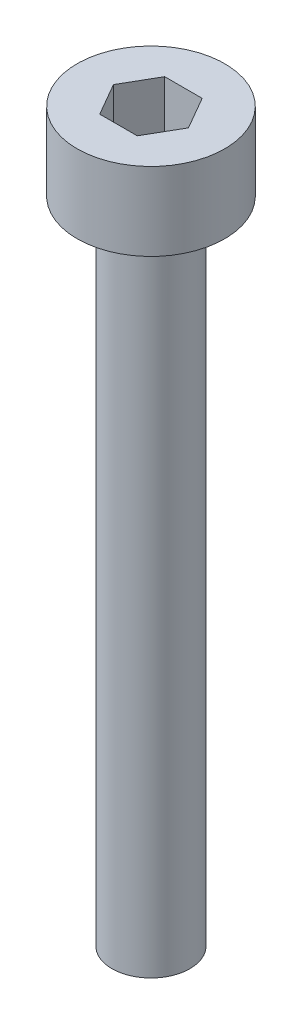
from build123d import *

# Parameters (mm, degrees)
SKETCH1_R           = 2.84
BOSS_EXTRUDE1_DEPTH = 3
SKETCH2_R           = 1.5
BOSS_EXTRUDE2_DEPTH = 25


with BuildPart() as part:
    # Sketch1 → Boss-Extrude1 (new body)
    with BuildSketch(Plane(origin=(0, 0, 0), x_dir=(1, 0, 0), z_dir=(0, 1, 0))):
        with Locations(Location((0, 0, 0), (0, 0, 270))):
            Circle(SKETCH1_R)
        Polygon((0.721687836, 1.25), (-0.721687836, 1.25), (-1.443375673, 0), (-0.721687836, -1.25), (0.721687836, -1.25), (1.443375673, 0), align=None, mode=Mode.SUBTRACT)
    extrude(amount=BOSS_EXTRUDE1_DEPTH)

    # Sketch2 → Boss-Extrude2 (add)
    with BuildSketch(Plane.XZ):
        with Locations(Location((0, 0, 0), (0, 0, 90))):
            Circle(SKETCH2_R)
    extrude(amount=BOSS_EXTRUDE2_DEPTH)


solid = part.part
